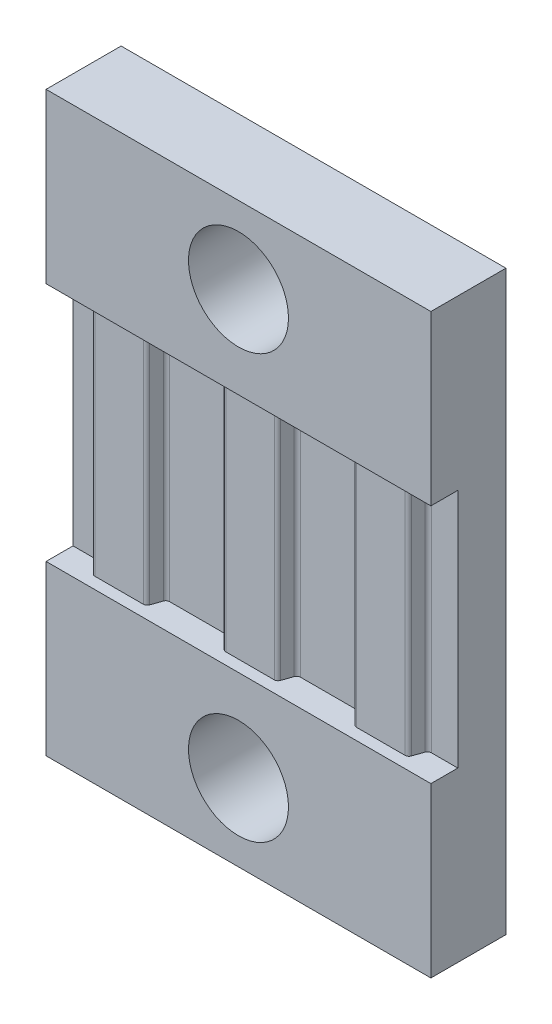
from build123d import *

# Parameters (mm, degrees)
SKETCH1_W           = 12.7
SKETCH1_H           = 19.05
SKETCH1_R           = 1.65
BOSS_EXTRUDE1_DEPTH = 1.5875
SKETCH2_W           = 12.7
SKETCH2_H           = 5.55625
SKETCH2_R           = 1.65
BOSS_EXTRUDE2_DEPTH = 0.889
BOSS_EXTRUDE3_REACH = 17.117
LPATTERN1_COUNT     = 2
LPATTERN1_PITCH     = 4.318
LPATTERN1_COL_COUNT = 2
LPATTERN1_COL_PITCH = 4.318


with BuildPart() as part:
    # Sketch1 → Boss-Extrude1 (new body)
    with BuildSketch(Plane.XY):
        Rectangle(SKETCH1_W, SKETCH1_H)
        with Locations((0, 6.985)):
            Circle(SKETCH1_R, mode=Mode.SUBTRACT)
        with Locations(Location((0, -6.985, 0), (0, 0, 180))):
            Circle(SKETCH1_R, mode=Mode.SUBTRACT)
    extrude(amount=BOSS_EXTRUDE1_DEPTH)

    # Sketch2 → Boss-Extrude2 (add)
    # profile 1 of 2: a face of its own
    with BuildSketch(Plane.XY.offset(1.5875)):
        with Locations((0, -6.746875)):
            Rectangle(SKETCH2_W, SKETCH2_H)
        with Locations(Location((0, -6.985, 0), (0, 0, 180))):
            Circle(SKETCH2_R, mode=Mode.SUBTRACT)
    # profile 2 of 2: a face of its own
    with BuildSketch(Plane.XY.offset(1.5875)):
        with Locations((0, 6.746875)):
            Rectangle(SKETCH2_W, SKETCH2_H)
        with Locations((0, 6.985)):
            Circle(SKETCH2_R, mode=Mode.SUBTRACT)
    extrude(amount=BOSS_EXTRUDE2_DEPTH)

    # Sketch3 → Boss-Extrude3 (add, up to next)
    with BuildSketch(Plane.XZ.offset(-3.96875), mode=Mode.PRIVATE) as boss_extrude3_sk1:
        with BuildLine():
            Line((-0.8001, 2.0955), (0.8001, 2.0955))
            ThreePointArc((0.8001, 2.0955), (0.873917251, 2.071844151), (0.920235135, 2.009689189))
            Line((0.920235135, 2.009689189), (1.035564865, 1.673310811))
            ThreePointArc((1.035564865, 1.673310811), (1.081882749, 1.611155849), (1.1557, 1.5875))
            Line((1.1557, 1.5875), (-1.1557, 1.5875))
            ThreePointArc((-1.1557, 1.5875), (-1.081882749, 1.611155849), (-1.035564865, 1.673310811))
            Line((-1.035564865, 1.673310811), (-0.920235135, 2.009689189))
            ThreePointArc((-0.920235135, 2.009689189), (-0.873917251, 2.071844151), (-0.8001, 2.0955))
        make_face()
    boss_extrude3_tool1 = extrude(boss_extrude3_sk1.sketch, amount=BOSS_EXTRUDE3_REACH, mode=Mode.PRIVATE) - part.part
    boss_extrude3 = boss_extrude3_tool1.solids().sort_by_distance((0, 3.96875, 1.832521))[0]
    add(boss_extrude3)

    # LPattern1: Boss-Extrude3 ×2
    with Locations(*[(i * LPATTERN1_PITCH, 0, 0) for i in range(1, LPATTERN1_COUNT)]):
        add(boss_extrude3)

    # LPattern1 col: Boss-Extrude3 ×2
    with Locations(*[(-i * LPATTERN1_COL_PITCH, 0, 0) for i in range(1, LPATTERN1_COL_COUNT)]):
        add(boss_extrude3)


solid = part.part
